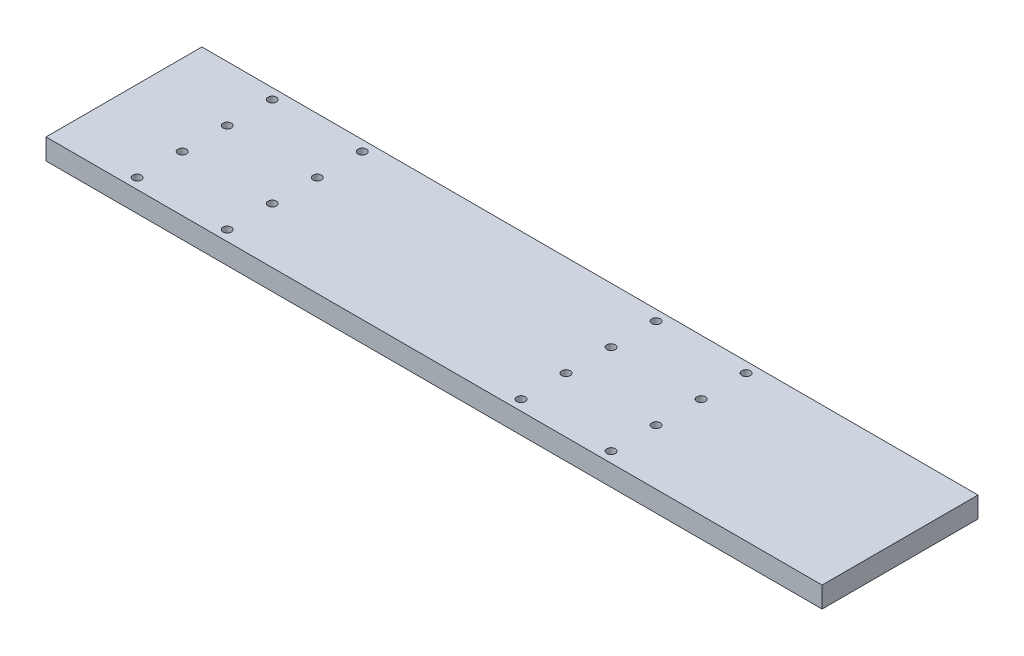
from build123d import *

# Parameters (mm, degrees)
BASE_SHOCK_PLATE_R             = 1.5
BASE_SHOCK_PLATE_EXTRUDE_DEPTH = 7.4


with BuildPart() as part:
    # Base-Shock-Plate → Base-Shock-Plate-Extrude (new body)
    with BuildSketch(Plane(origin=(0, 0, 0), x_dir=(1, 0, 0), z_dir=(0, 1, 0))):
        Polygon((250.8, -3.7), (0, -3.7), (-25, -3.7), (-25, 51.7), (0, 51.7), (250.8, 51.7), align=None)
        with Locations(Location((140.1, 16, 0), (0, 0, 270))):
            Circle(BASE_SHOCK_PLATE_R, mode=Mode.SUBTRACT)
        with Locations(Location((140.1, 48, 0), (0, 0, 270))):
            Circle(BASE_SHOCK_PLATE_R, mode=Mode.SUBTRACT)
        with Locations(Location((172.1, 0, 0), (0, 0, 270))):
            Circle(BASE_SHOCK_PLATE_R, mode=Mode.SUBTRACT)
        with Locations(Location((172.1, 32, 0), (0, 0, 270))):
            Circle(BASE_SHOCK_PLATE_R, mode=Mode.SUBTRACT)
        with Locations(Location((140.1, 32, 0), (0, 0, 270))):
            Circle(BASE_SHOCK_PLATE_R, mode=Mode.SUBTRACT)
        with Locations(Location((172.1, 48, 0), (0, 0, 270))):
            Circle(BASE_SHOCK_PLATE_R, mode=Mode.SUBTRACT)
        with Locations(Location((172.1, 16, 0), (0, 0, 270))):
            Circle(BASE_SHOCK_PLATE_R, mode=Mode.SUBTRACT)
        with Locations(Location((140.1, 0, 0), (0, 0, 270))):
            Circle(BASE_SHOCK_PLATE_R, mode=Mode.SUBTRACT)
        with Locations(Location((3.69999989, 16, 0), (0, 0, 270))):
            Circle(BASE_SHOCK_PLATE_R, mode=Mode.SUBTRACT)
        with Locations(Location((3.7, 48, 0), (0, 0, 270))):
            Circle(BASE_SHOCK_PLATE_R, mode=Mode.SUBTRACT)
        with Locations(Location((35.7, 0, 0), (0, 0, 270))):
            Circle(BASE_SHOCK_PLATE_R, mode=Mode.SUBTRACT)
        with Locations(Location((35.69999989, 32, 0), (0, 0, 270))):
            Circle(BASE_SHOCK_PLATE_R, mode=Mode.SUBTRACT)
        with Locations(Location((3.699999945, 32, 0), (0, 0, 270))):
            Circle(BASE_SHOCK_PLATE_R, mode=Mode.SUBTRACT)
        with Locations(Location((35.7, 48, 0), (0, 0, 270))):
            Circle(BASE_SHOCK_PLATE_R, mode=Mode.SUBTRACT)
        with Locations(Location((35.69999989, 16, 0), (0, 0, 270))):
            Circle(BASE_SHOCK_PLATE_R, mode=Mode.SUBTRACT)
        with Locations(Location((3.7, 0, 0), (0, 0, 270))):
            Circle(BASE_SHOCK_PLATE_R, mode=Mode.SUBTRACT)
    extrude(amount=BASE_SHOCK_PLATE_EXTRUDE_DEPTH)


solid = part.part
